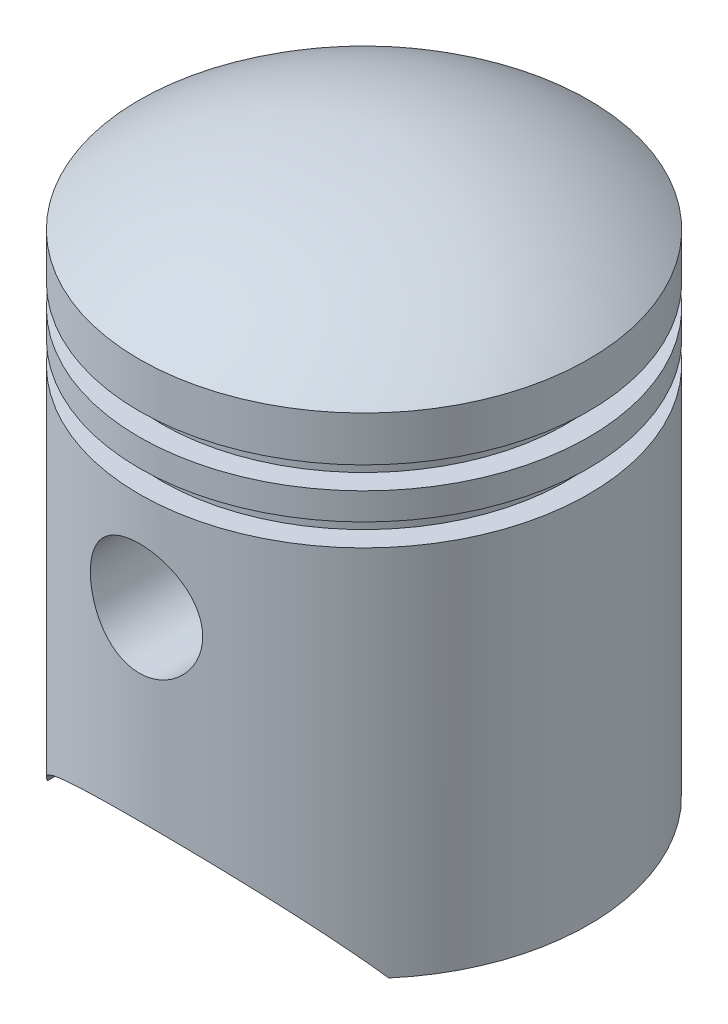
from build123d import *

# Parameters (mm, degrees)
CUT_EXTRUDE1_DEPTH       = 42.5
SKETCH3_R                = 6.25
CUT_EXTRUDE2_DEPTH       = 42.5
BOSS_EXTRUDE1_REACH      = 78.823
BOSS_EXTRUDE1_END_RADIUS = 23
SKETCH6_R                = 7.25
SKETCH6_R_2              = 6.25


with BuildPart() as part:
    # Sketch1 → Revolve1 (revolve)
    with BuildSketch(Plane.XY, mode=Mode.PRIVATE) as revolve1_sk:
        with BuildLine():
            Line((0, 62.5), (0, 60.49936285))
            ThreePointArc((0, 60.49936285), (12.069492637, 58.859165445), (23, 53.484511145))
            Line((23, 53.484511145), (23, 51.5))
            Line((23, 51.5), (20.5, 51.5))
            Line((20.5, 51.5), (20.5, 45.5))
            Line((20.5, 45.5), (20.5, 39.5))
            Line((20.5, 39.5), (23, 39.5))
            Line((23, 39.5), (23, 0))
            Line((23, 0), (25, 0))
            Line((25, 0), (25, 41.5))
            Line((25, 41.5), (22.5, 41.5))
            Line((22.5, 41.5), (22.5, 44))
            Line((22.5, 44), (25, 44))
            Line((25, 44), (25, 47))
            Line((25, 47), (22.5, 47))
            Line((22.5, 47), (22.5, 49.5))
            Line((22.5, 49.5), (25, 49.5))
            Line((25, 49.5), (25, 54.5))
            ThreePointArc((25, 54.5), (13.174901691, 60.609067785), (0, 62.5))
        make_face()
    revolve(revolve1_sk.sketch.rotate(Axis((0, 62.5, 0), (0, -1, 0)), 90), axis=Axis((0, 62.5, 0), (0, -1, 0)))

    # Sketch2 → Cut-Extrude1 (cut, symmetric)
    with BuildSketch(Plane.XY):
        with BuildLine():
            Line((19, 0), (-19, 0))
            ThreePointArc((-19, 0), (0, 10), (19, 0))
        make_face()
    extrude(amount=CUT_EXTRUDE1_DEPTH, both=True, mode=Mode.SUBTRACT)

    # Sketch3 → Cut-Extrude2 (cut, symmetric)
    with BuildSketch(Plane.XY):
        with Locations((0, 30.5)):
            Circle(SKETCH3_R)
    extrude(amount=CUT_EXTRUDE2_DEPTH, both=True, mode=Mode.SUBTRACT)

    # Boss-Extrude1: up to this cylinder (the profile starts inside it)
    boss_extrude1_end = Plane(origin=(0, 23.455061, 0), z_dir=(0, 1, 0)) * Cylinder(BOSS_EXTRUDE1_END_RADIUS, 204.646, mode=Mode.PRIVATE)
    # Sketch6 → Boss-Extrude1 (add, up to the surface)
    with BuildSketch(Plane.XY.offset(12), mode=Mode.PRIVATE) as boss_extrude1_sk1:
        with Locations(Location((0, 30.5, 0), (0, 0, 90))):
            Circle(SKETCH6_R)
        with Locations((0, 30.5)):
            Circle(SKETCH6_R_2, mode=Mode.SUBTRACT)
    boss_extrude1_tool1 = extrude(boss_extrude1_sk1.sketch, amount=BOSS_EXTRUDE1_REACH, mode=Mode.PRIVATE) & boss_extrude1_end
    boss_extrude1 = boss_extrude1_tool1.solids().sort_by_distance((0, 23.455061, 12))[0]
    add(boss_extrude1)

    # Mirror1: Boss-Extrude1 across plane
    add(boss_extrude1.mirror(Plane.XY))


solid = part.part
